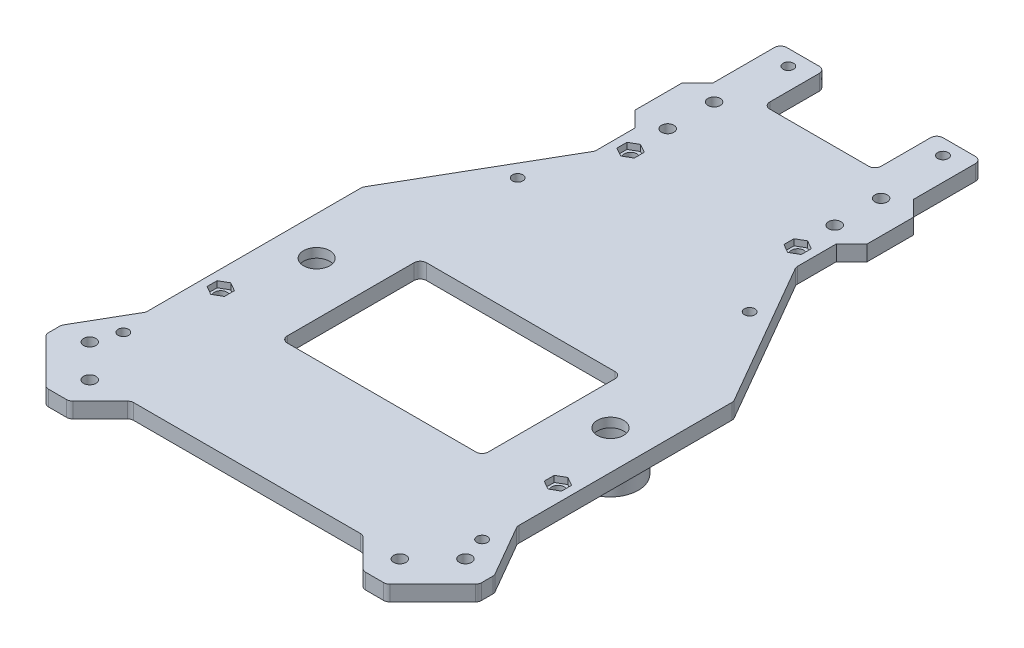
from build123d import *

# Parameters (mm, degrees)
SKETCH1_W                                       = 140
SKETCH1_H                                       = 220
BOSS_EXTRUDE1_DEPTH                             = 5
CUT_EXTRUDE1_DEPTH                              = 5
CHAMFER3_SIZE                                   = 15
F_4_0_4_DIAMETER_HOLE3_D                        = 4
F_4_0_4_DIAMETER_HOLE3_DEPTH                    = 5
F_4_0_4_DIAMETER_HOLE3_TIP                      = 1.201721238
CSK_FOR_M3_FLAT_HEAD_MACHINE_SCREW4_D           = 3.4
CSK_FOR_M3_FLAT_HEAD_MACHINE_SCREW4_DEPTH       = 5
CSK_FOR_M3_FLAT_HEAD_MACHINE_SCREW4_CSINK_D     = 6.3
CSK_FOR_M3_FLAT_HEAD_MACHINE_SCREW4_CSINK_ANGLE = 90
CSK_FOR_M3_FLAT_HEAD_MACHINE_SCREW4_TIP         = 1.021463052
SKETCH18_W                                      = 81.237331022
SKETCH18_H                                      = 9.628563132
CUT_EXTRUDE2_DEPTH                              = 5
CUT_EXTRUDE8_DEPTH                              = 10
SKETCH35_W                                      = 65
SKETCH35_H                                      = 45
CUT_EXTRUDE9_DEPTH                              = 131.479883507
FILLET1_R                                       = 2
CUT_EXTRUDE10_DEPTH                             = 131.479883507
SKETCH38_W                                      = 36
SKETCH38_H                                      = 20
CUT_EXTRUDE14_DEPTH                             = 131.479883507
SKETCH39_R                                      = 7
CUT_EXTRUDE15_DEPTH                             = 131.479883507
CSK_FOR_M3_FLAT_HEAD_MACHINE_SCREW3_D           = 3.4
CSK_FOR_M3_FLAT_HEAD_MACHINE_SCREW3_DEPTH       = 10
CSK_FOR_M3_FLAT_HEAD_MACHINE_SCREW3_CSINK_D     = 6.3
CSK_FOR_M3_FLAT_HEAD_MACHINE_SCREW3_CSINK_ANGLE = 90
CSK_FOR_M3_FLAT_HEAD_MACHINE_SCREW3_TIP         = 1.021463052
BOSS_EXTRUDE2_START                             = -3
SKETCH42_R                                      = 7
SKETCH42_R_2                                    = 4.25
BOSS_EXTRUDE2_DEPTH                             = 3
BOSS_EXTRUDE3_START                             = 8
SKETCH43_R                                      = 9
SKETCH43_R_2                                    = 7
BOSS_EXTRUDE3_DEPTH                             = 8
F_4_0MM_DOWEL_HOLE1_AT_2_COUNT                  = 2
F_4_0MM_DOWEL_HOLE1_AT_2_PITCH                  = 108.54146673
CUT_EXTRUDE16_DEPTH                             = 2
BOSS_EXTRUDE4_DEPTH                             = 5
CSK_FOR_M3_FLAT_HEAD_MACHINE_SCREW2_D           = 3.4
CSK_FOR_M3_FLAT_HEAD_MACHINE_SCREW2_DEPTH       = 5
CSK_FOR_M3_FLAT_HEAD_MACHINE_SCREW2_CSINK_D     = 6.3
CSK_FOR_M3_FLAT_HEAD_MACHINE_SCREW2_CSINK_ANGLE = 90
CSK_FOR_M3_FLAT_HEAD_MACHINE_SCREW2_TIP         = 1.021463052
FILLET3_R                                       = 2


with BuildPart() as part:
    # Sketch1 → Boss-Extrude1 (new body)
    with BuildSketch(Plane(origin=(0, 0, 0), x_dir=(1, 0, 0), z_dir=(0, 1, 0))):
        Rectangle(SKETCH1_W, SKETCH1_H)
    extrude(amount=BOSS_EXTRUDE1_DEPTH)

    # Sketch8 → Cut-Extrude1 (cut)
    with BuildSketch(Plane(origin=(0, 5, 0), x_dir=(1, 0, 0), z_dir=(0, 1, 0))):
        Polygon((-70, 110), (-32.5, 110), (-32.5, 44.951905284), (-70, -20), align=None)
        Polygon((70, 110), (70, -20), (32.5, 44.951905284), (32.5, 110), align=None)
    extrude(amount=-CUT_EXTRUDE1_DEPTH, mode=Mode.SUBTRACT)

    # Chamfer3
    chamfer3_edges = [part.edges().sort_by_distance(p)[0] for p in [
        (70, 2.5, 110),
        (-70, 2.5, 110),
    ]]
    chamfer(chamfer3_edges, length=CHAMFER3_SIZE)

    # Ø4.0 (4) Diameter Hole3
    with Locations(Plane(origin=(0, 5, 0), x_dir=(1, 0, 0), z_dir=(0, 1, 0))):
        with Locations((-27, 78), (-27, 63), (-60.732233047, -90.125631329), (-50.125631329, -100.732233047), (50.125631329, -100.732233047), (60.732233047, -90.125631329), (27, 63), (27, 78)):
            Hole(F_4_0_4_DIAMETER_HOLE3_D / 2, depth=F_4_0_4_DIAMETER_HOLE3_DEPTH)
            with Locations((0, 0, -(F_4_0_4_DIAMETER_HOLE3_DEPTH + F_4_0_4_DIAMETER_HOLE3_TIP / 2))):  # 118° drill point
                Cone(0, F_4_0_4_DIAMETER_HOLE3_D / 2, F_4_0_4_DIAMETER_HOLE3_TIP, mode=Mode.SUBTRACT)

    # CSK for M3 Flat Head Machine Screw4
    with Locations(Plane.XZ):
        with Locations((37.5, -25), (-37.5, -25), (-25, -100), (25, -100)):
            CounterSinkHole(CSK_FOR_M3_FLAT_HEAD_MACHINE_SCREW4_D / 2, CSK_FOR_M3_FLAT_HEAD_MACHINE_SCREW4_CSINK_D / 2, depth=CSK_FOR_M3_FLAT_HEAD_MACHINE_SCREW4_DEPTH, counter_sink_angle=CSK_FOR_M3_FLAT_HEAD_MACHINE_SCREW4_CSINK_ANGLE)
            with Locations((0, 0, -(CSK_FOR_M3_FLAT_HEAD_MACHINE_SCREW4_DEPTH + CSK_FOR_M3_FLAT_HEAD_MACHINE_SCREW4_TIP / 2))):  # 118° drill point
                Cone(0, CSK_FOR_M3_FLAT_HEAD_MACHINE_SCREW4_D / 2, CSK_FOR_M3_FLAT_HEAD_MACHINE_SCREW4_TIP, mode=Mode.SUBTRACT)

    # Sketch18 → Cut-Extrude2 (cut)
    with BuildSketch(Plane(origin=(0, 5, 0), x_dir=(1, 0, 0), z_dir=(0, 1, 0))):
        with Locations((-5.815131093, 109.814281566)):
            Rectangle(SKETCH18_W, SKETCH18_H)
    extrude(amount=-CUT_EXTRUDE2_DEPTH, mode=Mode.SUBTRACT)

    # Sketch34 → Cut-Extrude8 (cut)
    with BuildSketch(Plane(origin=(0, 5, 0), x_dir=(1, 0, 0), z_dir=(0, 1, 0))):
        Polygon((-70, -20), (-60, -2.679491924), (-60, -72.679491924), (-70, -90), align=None)
        Polygon((70, -90), (70, -20), (60, -2.679491924), (60, -72.679491924), align=None)
    extrude(amount=-CUT_EXTRUDE8_DEPTH, mode=Mode.SUBTRACT)

    # Sketch35 → Cut-Extrude9 (cut, through all)
    with BuildSketch(Plane(origin=(0, 5, 0), x_dir=(1, 0, 0), z_dir=(0, 1, 0))):
        with Locations((2, -36)):
            Rectangle(SKETCH35_W, SKETCH35_H)
    extrude(amount=-CUT_EXTRUDE9_DEPTH, mode=Mode.SUBTRACT)

    # Fillet1
    fillet1_edges = [part.edges().sort_by_distance(p)[0] for p in [
        (34.5, 2.5, 13.5),
        (34.5, 2.5, 58.5),
        (-30.5, 2.5, 58.5),
        (-30.5, 2.5, 13.5),
    ]]
    fillet(fillet1_edges, radius=FILLET1_R)

    # Sketch36 → Cut-Extrude10 (cut, through all)
    with BuildSketch(Plane(origin=(0, 5, 0), x_dir=(1, 0, 0), z_dir=(0, 1, 0))):
        Polygon((-47.5, -110), (-37.5, -100), (37.5, -100), (47.5, -110), align=None)
    extrude(amount=-CUT_EXTRUDE10_DEPTH, mode=Mode.SUBTRACT)

    # Sketch38 → Cut-Extrude14 (cut, through all)
    with BuildSketch(Plane.XZ):
        with Locations((0, -95)):
            Rectangle(SKETCH38_W, SKETCH38_H)
    extrude(amount=-CUT_EXTRUDE14_DEPTH, mode=Mode.SUBTRACT)

    # Sketch39 → Cut-Extrude15 (cut, through all)
    with BuildSketch(Plane.XZ):
        with Locations(Location((-47.5, 30, 0), (0, 0, 270))):
            Circle(SKETCH39_R)
        with Locations(Location((47.5, 30, 0), (0, 0, 90))):
            Circle(SKETCH39_R)
    extrude(amount=-CUT_EXTRUDE15_DEPTH, mode=Mode.SUBTRACT)

    # CSK for M3 Flat Head Machine Screw3
    with Locations(Plane(origin=(0, 0, 0), x_dir=(-1, 0, 0), z_dir=(0, -1, 0))):
        with Locations((-58, -82), (58, -82)):
            CounterSinkHole(CSK_FOR_M3_FLAT_HEAD_MACHINE_SCREW3_D / 2, CSK_FOR_M3_FLAT_HEAD_MACHINE_SCREW3_CSINK_D / 2, depth=CSK_FOR_M3_FLAT_HEAD_MACHINE_SCREW3_DEPTH, counter_sink_angle=CSK_FOR_M3_FLAT_HEAD_MACHINE_SCREW3_CSINK_ANGLE)
            with Locations((0, 0, -(CSK_FOR_M3_FLAT_HEAD_MACHINE_SCREW3_DEPTH + CSK_FOR_M3_FLAT_HEAD_MACHINE_SCREW3_TIP / 2))):  # 118° drill point
                Cone(0, CSK_FOR_M3_FLAT_HEAD_MACHINE_SCREW3_D / 2, CSK_FOR_M3_FLAT_HEAD_MACHINE_SCREW3_TIP, mode=Mode.SUBTRACT)

    # Sketch42 → Boss-Extrude2 (add)
    # profile 1 of 2: a face of its own
    with BuildSketch(Plane(origin=(0, 5, 0), x_dir=(1, 0, 0), z_dir=(0, 1, 0)).offset(BOSS_EXTRUDE2_START)):
        with Locations(Location((-47.5, -30, 0), (0, 0, 90))):
            Circle(SKETCH42_R)
        with Locations(Location((-47.5, -30, 0), (0, 0, 270))):
            Circle(SKETCH42_R_2, mode=Mode.SUBTRACT)
    # profile 2 of 2: a face of its own
    with BuildSketch(Plane(origin=(0, 5, 0), x_dir=(1, 0, 0), z_dir=(0, 1, 0)).offset(BOSS_EXTRUDE2_START)):
        with Locations(Location((47.5, -30, 0), (0, 0, 90))):
            Circle(SKETCH42_R)
        with Locations(Location((47.5, -30, 0), (0, 0, 90))):
            Circle(SKETCH42_R_2, mode=Mode.SUBTRACT)
    extrude(amount=BOSS_EXTRUDE2_DEPTH)

    # Sketch43 → Boss-Extrude3 (add)
    # profile 1 of 2: a face of its own
    with BuildSketch(Plane.XZ.offset(BOSS_EXTRUDE3_START)):
        with Locations(Location((-47.5, 30, 0), (0, 0, 90))):
            Circle(SKETCH43_R)
        with Locations(Location((-47.5, 30, 0), (0, 0, 270))):
            Circle(SKETCH43_R_2, mode=Mode.SUBTRACT)
    # profile 2 of 2: a face of its own
    with BuildSketch(Plane.XZ.offset(BOSS_EXTRUDE3_START)):
        with Locations(Location((47.5, 30, 0), (0, 0, 90))):
            Circle(SKETCH43_R)
        with Locations(Location((47.5, 30, 0), (0, 0, 270))):
            Circle(SKETCH43_R_2, mode=Mode.SUBTRACT)
    extrude(amount=-BOSS_EXTRUDE3_DEPTH)

    # Sketch46 → Ø4.0mm Dowel Hole1 (revolve, cut)
    with BuildSketch(Plane(origin=(-54.5, 5, 54), x_dir=(0, 0, 1), z_dir=(1, 0, 0))):
        Polygon((0, 0), (0, 6.201721238), (2, 5), (2, 0), align=None)
    f_4_0mm_dowel_hole1 = revolve(axis=Axis((-54.5, 11.35, 54), (0, -1, 0)), mode=Mode.SUBTRACT)

    # Ø4.0mm Dowel Hole1 at 2: Ø4.0mm Dowel Hole1 ×2
    with Locations(*[Vector(0.2533593918376833, 0, -0.9673722233802454) * (i * F_4_0MM_DOWEL_HOLE1_AT_2_PITCH) for i in range(1, F_4_0MM_DOWEL_HOLE1_AT_2_COUNT)]):
        add(f_4_0mm_dowel_hole1, mode=Mode.SUBTRACT)

    # Mirror1: Ø4.0mm Dowel Hole1 across plane
    add(f_4_0mm_dowel_hole1.mirror(Plane(origin=(0, 0, 0), x_dir=(0, 0, 1), z_dir=(1, 0, 0))), mode=Mode.SUBTRACT)

    # Mirror1 copy 1 sketch → Mirror1 copy 1 (revolve, cut)
    with BuildSketch(Plane(origin=(27, 5, -51), x_dir=(0, 0, 1), z_dir=(-1, 0, 0))):
        Polygon((0, 0), (0, -6.201721238), (2, -5), (2, 0), align=None)
    revolve(axis=Axis((27, 11.35, -51), (0, 1, 0)), mode=Mode.SUBTRACT)

    # Sketch47 → Cut-Extrude16 (cut)
    with BuildSketch(Plane(origin=(0, 5, 0), x_dir=(1, 0, 0), z_dir=(0, 1, 0))):
        Polygon((29.8, 49.383419246), (29.8, 52.616580754), (27, 54.233161507), (24.2, 52.616580754), (24.2, 49.383419246), (27, 47.766838493), align=None)
        Polygon((57.3, -55.616580754), (57.3, -52.383419246), (54.5, -50.766838493), (51.7, -52.383419246), (51.7, -55.616580754), (54.5, -57.233161507), align=None)
        Polygon((-54.5, -57.233161507), (-57.3, -55.616580754), (-57.3, -52.383419246), (-54.5, -50.766838493), (-51.7, -52.383419246), (-51.7, -55.616580754), align=None)
        Polygon((-27, 47.766838493), (-29.8, 49.383419246), (-29.8, 52.616580754), (-27, 54.233161507), (-24.2, 52.616580754), (-24.2, 49.383419246), align=None)
    extrude(amount=-CUT_EXTRUDE16_DEPTH, mode=Mode.SUBTRACT)

    # Sketch48 → Boss-Extrude4 (add)
    with BuildSketch(Plane(origin=(0, 5, 0), x_dir=(1, 0, 0), z_dir=(0, 1, 0))):
        Polygon((32.5, 58), (32.5, 83), (37.5, 78), (37.5, 63), align=None)
        Polygon((-32.5, 58), (-37.5, 63), (-37.5, 78), (-32.5, 83), align=None)
    extrude(amount=-BOSS_EXTRUDE4_DEPTH)

    # CSK for M3 Flat Head Machine Screw2
    with Locations(Plane(origin=(0, 0, 0), x_dir=(-1, 0, 0), z_dir=(0, -1, 0))):
        with Locations((27, 63), (27, 78), (-27, 78), (-27, 63), (60.732233047, -90.125631329), (50.125631329, -100.732233047), (-50.125631329, -100.732233047), (-60.732233047, -90.125631329)):
            CounterSinkHole(CSK_FOR_M3_FLAT_HEAD_MACHINE_SCREW2_D / 2, CSK_FOR_M3_FLAT_HEAD_MACHINE_SCREW2_CSINK_D / 2, depth=CSK_FOR_M3_FLAT_HEAD_MACHINE_SCREW2_DEPTH, counter_sink_angle=CSK_FOR_M3_FLAT_HEAD_MACHINE_SCREW2_CSINK_ANGLE)
            with Locations((0, 0, -(CSK_FOR_M3_FLAT_HEAD_MACHINE_SCREW2_DEPTH + CSK_FOR_M3_FLAT_HEAD_MACHINE_SCREW2_TIP / 2))):  # 118° drill point
                Cone(0, CSK_FOR_M3_FLAT_HEAD_MACHINE_SCREW2_D / 2, CSK_FOR_M3_FLAT_HEAD_MACHINE_SCREW2_TIP, mode=Mode.SUBTRACT)

    # Fillet3
    fillet3_edges = [part.edges().sort_by_distance(p)[0] for p in [
        (-32.5, 2.5, -105),
        (32.5, 2.5, -105),
        (-60, 2.5, 2.679491924),
        (60, 2.5, 2.679491924),
        (-60, 2.5, 72.679491924),
        (-70, 2.5, 90),
        (70, 2.5, 90),
        (60, 2.5, 72.679491924),
        (-32.5, 2.5, -44.951905284),
        (47.5, 2.5, 110),
        (-47.5, 2.5, 110),
        (-37.5, 2.5, 100),
        (37.5, 2.5, 100),
        (18, 2.5, -105),
        (-18, 2.5, -105),
        (-18, 2.5, -85),
        (18, 2.5, -85),
        (32.5, 2.5, -44.951905284),
        (70, 2.5, 95),
        (-55, 2.5, 110),
        (55, 2.5, 110),
        (-70, 2.5, 95),
    ]]
    fillet(fillet3_edges, radius=FILLET3_R)


solid = part.part
